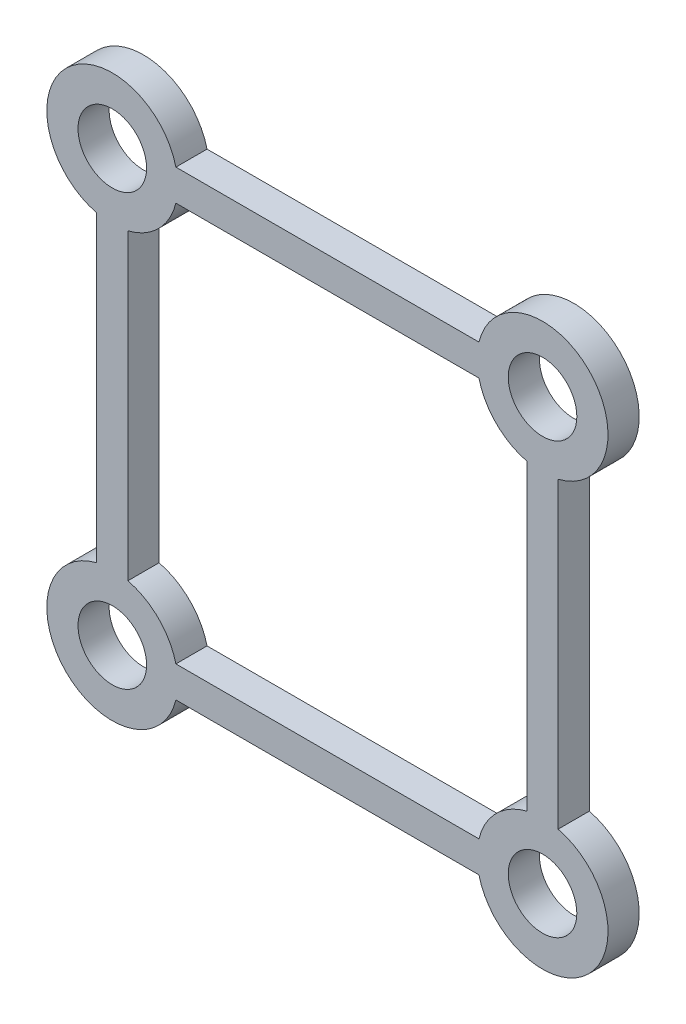
from build123d import *

# Parameters (mm, degrees)
SKETCH1_R           = 1.1
BOSS_EXTRUDE1_DEPTH = 1


with BuildPart() as part:
    # Sketch1 → Boss-Extrude1 (new body)
    with BuildSketch(Plane(origin=(0, 0, 0), x_dir=(0, 1, 0), z_dir=(0, 0, 1))):
        with BuildLine():
            Line((-4.860392195, 7.4), (4.860392195, 7.4))
            ThreePointArc((4.860392195, 7.4), (8.38492424, 8.38492424), (7.4, 4.860392195))
            Line((7.4, 4.860392195), (7.4, -4.860392195))
            ThreePointArc((7.4, -4.860392195), (8.38492424, -8.38492424), (4.860392195, -7.4))
            Line((4.860392195, -7.4), (-4.860392195, -7.4))
            ThreePointArc((-4.860392195, -7.4), (-8.38492424, -8.38492424), (-7.4, -4.860392195))
            Line((-7.4, -4.860392195), (-7.4, 4.860392195))
            ThreePointArc((-7.4, 4.860392195), (-8.38492424, 8.38492424), (-4.860392195, 7.4))
        make_face()
        with Locations((-6.9, 6.9)):
            Circle(SKETCH1_R, mode=Mode.SUBTRACT)
        with Locations((6.9, 6.9)):
            Circle(SKETCH1_R, mode=Mode.SUBTRACT)
        with Locations((6.9, -6.9)):
            Circle(SKETCH1_R, mode=Mode.SUBTRACT)
        with Locations((-6.9, -6.9)):
            Circle(SKETCH1_R, mode=Mode.SUBTRACT)
        with BuildLine():
            Line((-4.860392195, 6.4), (4.860392195, 6.4))
            ThreePointArc((4.860392195, 6.4), (5.41507576, 5.41507576), (6.4, 4.860392195))
            Line((6.4, 4.860392195), (6.4, -4.860392195))
            ThreePointArc((6.4, -4.860392195), (5.41507576, -5.41507576), (4.860392195, -6.4))
            Line((4.860392195, -6.4), (-4.860392195, -6.4))
            ThreePointArc((-4.860392195, -6.4), (-5.41507576, -5.41507576), (-6.4, -4.860392195))
            Line((-6.4, -4.860392195), (-6.4, 4.860392195))
            ThreePointArc((-6.4, 4.860392195), (-5.41507576, 5.41507576), (-4.860392195, 6.4))
        make_face(mode=Mode.SUBTRACT)
    extrude(amount=BOSS_EXTRUDE1_DEPTH)


solid = part.part
